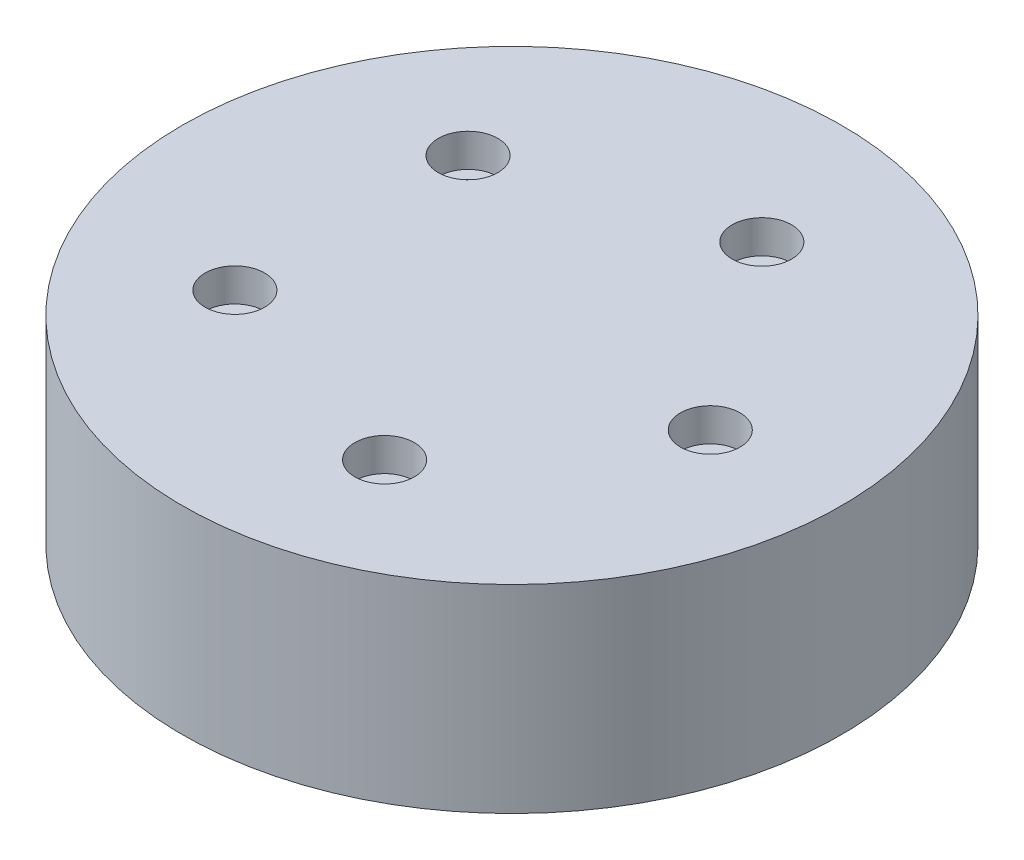
from build123d import *

# Parameters (mm, degrees)
BOSS_EXTRUDE1_DEPTH              = 5
BOSS_EXTRUDE1_DEPTH_BACK         = 10
SKETCH3_R                        = 24.925
SKETCH3_R_2                      = 1.3
SKETCH6_R                        = 1.65
CUT_EXTRUDE1_DEPTH               = 5
CBORE_FOR_M2_5_SHCS1_D           = 2.5
CBORE_FOR_M2_5_SHCS1_CBORE_D     = 4.5
CBORE_FOR_M2_5_SHCS1_CBORE_DEPTH = 2.5


with BuildPart() as part:
    # Sketch3 → Boss-Extrude1 (new, two sides: drawn at the far end of the back side and taken through both)
    with BuildSketch(Plane(origin=(0, 15, 0), x_dir=(1, 0, 0), z_dir=(0, 1, 0)).offset(-BOSS_EXTRUDE1_DEPTH_BACK)):
        with Locations(Location((-1.2, 0, 0), (0, 0, 180))):
            Circle(SKETCH3_R)
        with Locations(Location((13.8, 0, 0), (0, 0, 180))):
            Circle(SKETCH3_R_2, mode=Mode.SUBTRACT)
        with Locations(Location((3.435254916, -14.265847744, 0), (0, 0, 180))):
            Circle(SKETCH3_R_2, mode=Mode.SUBTRACT)
        with Locations(Location((-13.335254916, -8.816778784, 0), (0, 0, 180))):
            Circle(SKETCH3_R_2, mode=Mode.SUBTRACT)
        with Locations(Location((-13.335254916, 8.816778784, 0), (0, 0, 180))):
            Circle(SKETCH3_R_2, mode=Mode.SUBTRACT)
        with Locations(Location((3.435254916, 14.265847744, 0), (0, 0, 180))):
            Circle(SKETCH3_R_2, mode=Mode.SUBTRACT)
    extrude(amount=BOSS_EXTRUDE1_DEPTH + BOSS_EXTRUDE1_DEPTH_BACK)

    # Sketch6 → Cut-Extrude1 (cut)
    with BuildSketch(Plane.XZ.offset(-5)):
        with Locations((13.8, 0)):
            Circle(SKETCH6_R)
        with Locations((3.435254916, -14.265847744)):
            Circle(SKETCH6_R)
        with Locations((-13.335254915, -8.816778784)):
            Circle(SKETCH6_R)
        with Locations((-13.335254915, 8.816778784)):
            Circle(SKETCH6_R)
        with Locations((3.435254916, 14.265847744)):
            Circle(SKETCH6_R)
    extrude(amount=-CUT_EXTRUDE1_DEPTH, mode=Mode.SUBTRACT)

    # CBORE for M2.5 SHCS1 (through all)
    with Locations(Plane(origin=(0, 20, 0), x_dir=(1, 0, 0), z_dir=(0, 1, 0))):
        with Locations((13.8, 0), (3.435254916, -14.265847744), (-13.335254916, -8.816778784), (3.435254916, 14.265847744), (-13.335254916, 8.816778784)):
            CounterBoreHole(CBORE_FOR_M2_5_SHCS1_D / 2, CBORE_FOR_M2_5_SHCS1_CBORE_D / 2, CBORE_FOR_M2_5_SHCS1_CBORE_DEPTH)


solid = part.part
